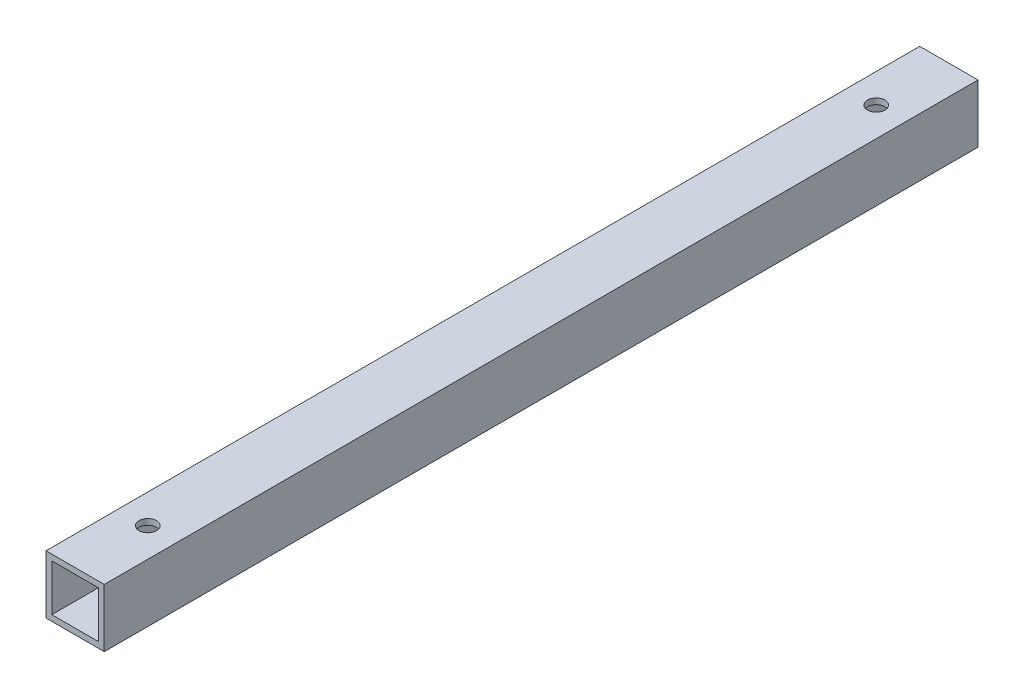
from build123d import *

# Parameters (mm, degrees)
SKETCH_1_W      = 10
SKETCH_1_H      = 10
SKETCH_1_W_2    = 8
SKETCH_1_H_2    = 8
EXTRUDE_1_DEPTH = 75
HOLE_WIZARD_1_D = 3


with BuildPart() as part:
    # 草图1 → 凸台-拉伸1 (new, symmetric)
    with BuildSketch(Plane.XY):
        Rectangle(SKETCH_1_W, SKETCH_1_H)
        Rectangle(SKETCH_1_W_2, SKETCH_1_H_2, mode=Mode.SUBTRACT)
    extrude(amount=EXTRUDE_1_DEPTH, both=True)

    # 孔1 (through all)
    with Locations(Plane(origin=(0, -5, 0), x_dir=(-1, 0, 0), z_dir=(0, -1, 0))):
        with Locations((-0.001638583, -62.522310915), (-0.001638583, 62.529577922)):
            Hole(HOLE_WIZARD_1_D / 2)


solid = part.part
